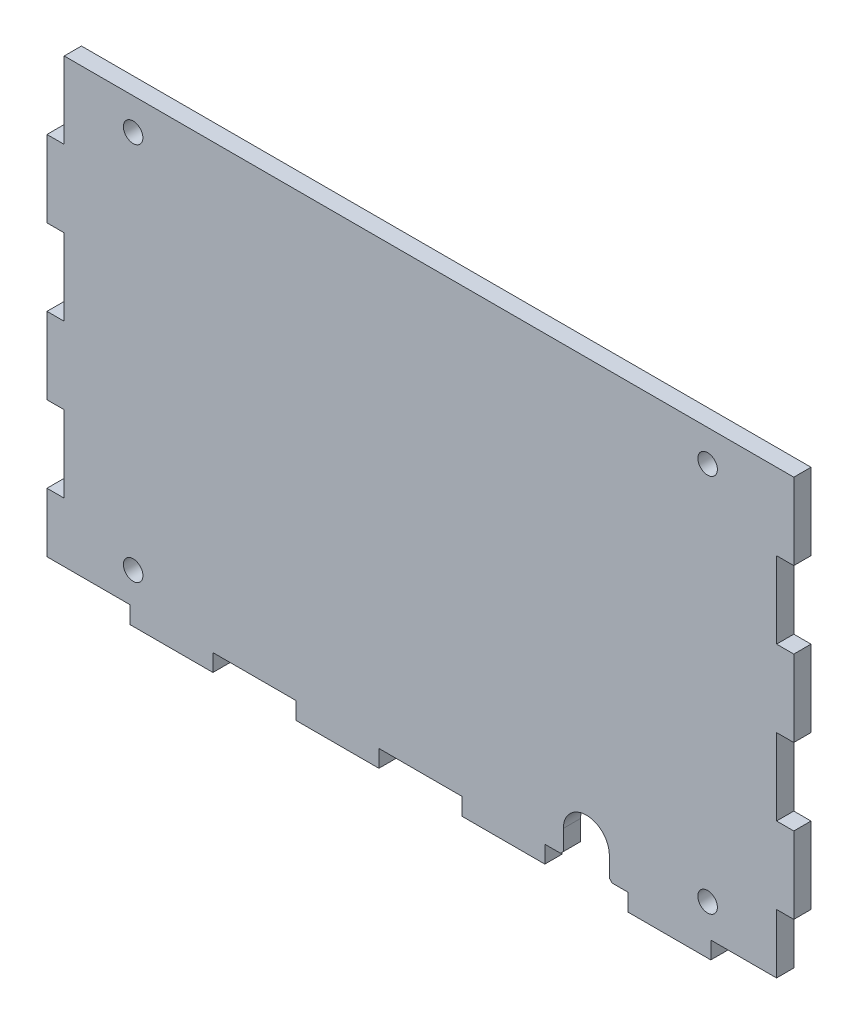
from build123d import *

# Parameters (mm, degrees)
SKETCH1_W                      = 130
SKETCH1_H                      = 80
BOSS_EXTRUDE1_DEPTH            = 3
SKETCH2_W                      = 14.444444444
SKETCH2_H                      = 3
SKETCH2_W_2                    = 3
SKETCH2_H_2                    = 13.333333334
SKETCH2_H_3                    = 13.333333333
CUT_TABS_DEPTH                 = 153.672852859
CUT_CORNERPIECE_HOLES_REACH    = 154.673
SKETCH3_R                      = 1.7
CUT_POWER_CORD_CLEARANCE_REACH = 154.673
CHAMFER1_SIZE                  = 0.5


with BuildPart() as part:
    # Sketch1 → Boss-Extrude1 (new body)
    with BuildSketch(Plane.XY):
        with Locations((65, 40)):
            Rectangle(SKETCH1_W, SKETCH1_H)
    extrude(amount=BOSS_EXTRUDE1_DEPTH)

    # Sketch2 → Cut tabs (cut, through all)
    with BuildSketch(Plane.XY.offset(3)):
        with Locations((7.222222222, 1.5)):
            Rectangle(SKETCH2_W, SKETCH2_H)
        with Locations((36.111111111, 1.5)):
            Rectangle(SKETCH2_W, SKETCH2_H)
        with Locations((65, 1.5)):
            Rectangle(SKETCH2_W, SKETCH2_H)
        with Locations((93.888888889, 1.5)):
            Rectangle(SKETCH2_W, SKETCH2_H)
        Polygon((115.555555556, 0), (115.555555556, 3), (127, 3), (127, 13.333333333), (130, 13.333333333), (130, 0), align=None)
        with Locations((1.5, 20)):
            Rectangle(SKETCH2_W_2, SKETCH2_H_2)
        with Locations((1.5, 46.666666667)):
            Rectangle(SKETCH2_W_2, SKETCH2_H_3)
        with Locations((1.5, 73.333333334)):
            Rectangle(SKETCH2_W_2, SKETCH2_H_3)
        with Locations((128.5, 33.333333334)):
            Rectangle(SKETCH2_W_2, SKETCH2_H_3)
        with Locations((128.5, 60)):
            Rectangle(SKETCH2_W_2, SKETCH2_H_2)
    extrude(amount=-CUT_TABS_DEPTH, mode=Mode.SUBTRACT)

    # Sketch3 → Cut cornerpiece holes (cut, up to next)
    with BuildSketch(Plane.XY.offset(3), mode=Mode.PRIVATE) as cut_cornerpiece_holes_sk1:
        with Locations((15, 74.5)):
            Circle(SKETCH3_R)
    cut_cornerpiece_holes_tool1 = extrude(cut_cornerpiece_holes_sk1.sketch, amount=-CUT_CORNERPIECE_HOLES_REACH, mode=Mode.PRIVATE) & part.part
    # Sketch3 → Cut cornerpiece holes (cut, up to next)
    with BuildSketch(Plane.XY.offset(3), mode=Mode.PRIVATE) as cut_cornerpiece_holes_sk2:
        with Locations((115, 74.5)):
            Circle(SKETCH3_R)
    cut_cornerpiece_holes_tool2 = extrude(cut_cornerpiece_holes_sk2.sketch, amount=-CUT_CORNERPIECE_HOLES_REACH, mode=Mode.PRIVATE) & part.part
    # Sketch3 → Cut cornerpiece holes (cut, up to next)
    with BuildSketch(Plane.XY.offset(3), mode=Mode.PRIVATE) as cut_cornerpiece_holes_sk3:
        with Locations((15, 8.5)):
            Circle(SKETCH3_R)
    cut_cornerpiece_holes_tool3 = extrude(cut_cornerpiece_holes_sk3.sketch, amount=-CUT_CORNERPIECE_HOLES_REACH, mode=Mode.PRIVATE) & part.part
    # Sketch3 → Cut cornerpiece holes (cut, up to next)
    with BuildSketch(Plane.XY.offset(3), mode=Mode.PRIVATE) as cut_cornerpiece_holes_sk4:
        with Locations((115, 8.5)):
            Circle(SKETCH3_R)
    cut_cornerpiece_holes_tool4 = extrude(cut_cornerpiece_holes_sk4.sketch, amount=-CUT_CORNERPIECE_HOLES_REACH, mode=Mode.PRIVATE) & part.part
    add(cut_cornerpiece_holes_tool1.solids().sort_by_distance((15, 74.5, 3))[0], mode=Mode.SUBTRACT)
    add(cut_cornerpiece_holes_tool2.solids().sort_by_distance((115, 74.5, 3))[0], mode=Mode.SUBTRACT)
    add(cut_cornerpiece_holes_tool3.solids().sort_by_distance((15, 8.5, 3))[0], mode=Mode.SUBTRACT)
    add(cut_cornerpiece_holes_tool4.solids().sort_by_distance((115, 8.5, 3))[0], mode=Mode.SUBTRACT)

    # Sketch4 → Cut power cord clearance (cut, up to next)
    with BuildSketch(Plane(origin=(0, 0, 0), x_dir=(-1, 0, 0), z_dir=(0, 0, -1)), mode=Mode.PRIVATE) as cut_power_cord_clearance_sk1:
        with BuildLine():
            Line((-97.888888889, 3), (-97.888888889, 7))
            ThreePointArc((-97.888888889, 7), (-93.888888889, 11), (-89.888888889, 7))
            Line((-89.888888889, 7), (-89.888888889, 3))
            Line((-89.888888889, 3), (-97.888888889, 3))
        make_face()
    cut_power_cord_clearance_tool1 = extrude(cut_power_cord_clearance_sk1.sketch, amount=-CUT_POWER_CORD_CLEARANCE_REACH, mode=Mode.PRIVATE) & part.part
    add(cut_power_cord_clearance_tool1.solids().sort_by_distance((93.888889, 6.626601, 0))[0], mode=Mode.SUBTRACT)

    # Chamfer1
    chamfer1_edges = [part.edges().sort_by_distance(p)[0] for p in [
        (89.888888889, 3, 1.5),
        (97.888888889, 3, 1.5),
    ]]
    chamfer(chamfer1_edges, length=CHAMFER1_SIZE)


solid = part.part
